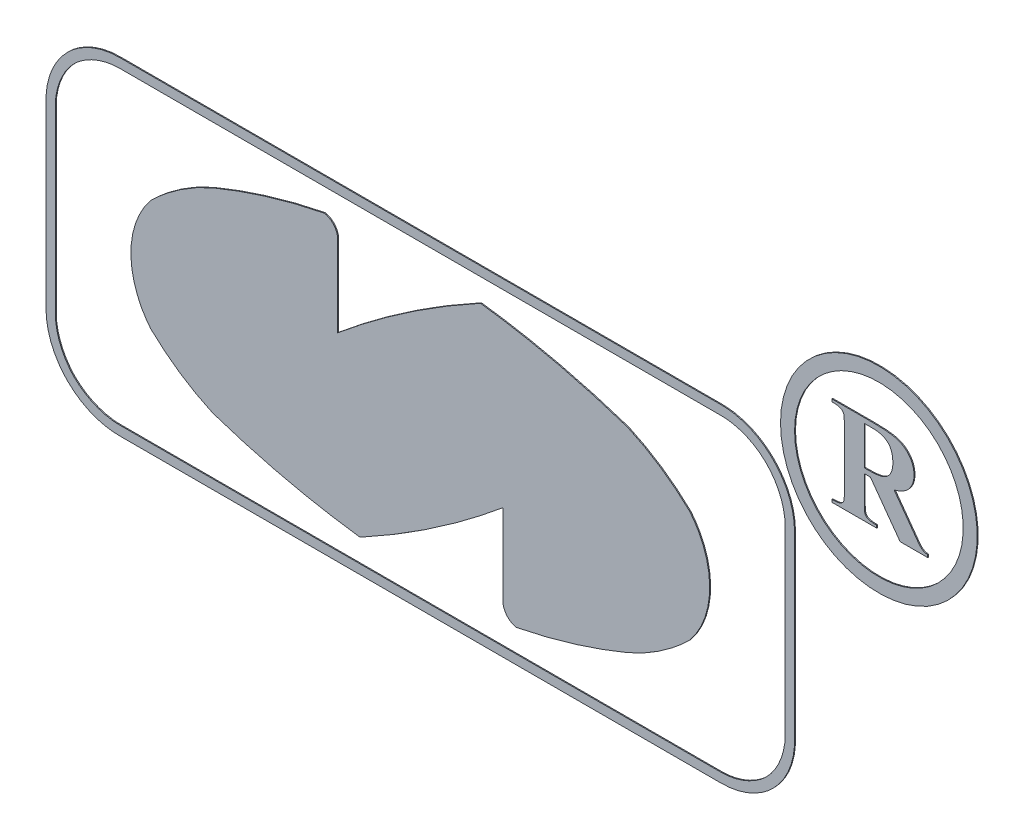
from build123d import *

# Parameters (mm, degrees)
SKETCH_1_R        = 1.05
SKETCH_1_R_2      = 0.9
EXTRUDE_1_DEPTH   = 0.01
EXTRUDE_1_2_DEPTH = 0.01
EXTRUDE_1_3_DEPTH = 0.01
EXTRUDE_2_DEPTH   = 0.01


with BuildPart() as part:
    # Эскиз1 → Вытянуть1 (new body)
    with BuildSketch(Plane.XY):
        with Locations(Location((4.87, 1.9247, 0), (0, 0, 180))):
            Circle(SKETCH_1_R)
        with Locations(Location((4.87, 1.9247, 0), (0, 0, 180))):
            Circle(SKETCH_1_R_2, mode=Mode.SUBTRACT)
    extrude(amount=EXTRUDE_1_DEPTH)


with BuildPart() as body_2:
    # Эскиз1 → Extrude 1 2 (new body)
    with BuildSketch(Plane.XY):
        with BuildLine():
            Line((3.1861, 1.7736), (-3.2358, 1.7736))
            add(Edge.make_bspline(
                [(-3.2358, 1.7736), (-3.444, 1.7736), (-3.6433, 1.6909), (-3.7904, 1.544)],
                knots=[0, 0, 0, 0, 0.5, 0.5, 0.5, 0.5], degree=3))
            add(Edge.make_bspline(
                [(-3.7904, 1.544), (-3.9374, 1.3968), (-4.0201, 1.1976), (-4.0201, 0.9894)],
                knots=[0.5, 0.5, 0.5, 0.5, 1, 1, 1, 1], degree=3))
            Line((-4.0201, 0.9894), (-4.0201, -0.94))
            add(Edge.make_bspline(
                [(-4.0201, -0.94), (-4.0201, -1.1481), (-3.9374, -1.3474), (-3.7904, -1.4946)],
                knots=[0, 0, 0, 0, 0.5, 0.5, 0.5, 0.5], degree=3))
            add(Edge.make_bspline(
                [(-3.7904, -1.4946), (-3.6433, -1.6415), (-3.444, -1.7242), (-3.2358, -1.7242)],
                knots=[0.5, 0.5, 0.5, 0.5, 1, 1, 1, 1], degree=3))
            Line((-3.2358, -1.7242), (3.1861, -1.7242))
            add(Edge.make_bspline(
                [(3.1861, -1.7242), (3.3941, -1.7242), (3.5937, -1.6415), (3.7405, -1.4946)],
                knots=[0, 0, 0, 0, 0.5, 0.5, 0.5, 0.5], degree=3))
            add(Edge.make_bspline(
                [(3.7405, -1.4946), (3.8876, -1.3474), (3.97, -1.1481), (3.97, -0.94)],
                knots=[0.5, 0.5, 0.5, 0.5, 1, 1, 1, 1], degree=3))
            Line((3.97, -0.94), (3.97, 0.9894))
            add(Edge.make_bspline(
                [(3.97, 0.9894), (3.97, 1.4226), (3.6193, 1.7736), (3.1861, 1.7736)],
                knots=[0, 0, 0, 0, 1, 1, 1, 1], degree=3))
        make_face()
        with BuildLine():
            Line((3.1861, 1.6736), (-3.2358, 1.6736))
            add(Edge.make_bspline(
                [(-3.2358, 1.6736), (-3.410370349, 1.6736), (-3.596153303, 1.596632942), (-3.719689323, 1.473289283)],
                knots=[0, 0, 0, 0, 0.499937556, 0.499937556, 0.499937556, 0.499937556], degree=3))
            add(Edge.make_bspline(
                [(-3.719689323, 1.473289283), (-3.843042067, 1.349744337), (-3.9201, 1.163983084), (-3.9201, 0.9894)],
                knots=[0.500062392, 0.500062392, 0.500062392, 0.500062392, 1, 1, 1, 1], degree=3))
            Line((-3.9201, 0.9894), (-3.9201, -0.94))
            add(Edge.make_bspline(
                [(-3.9201, -0.94), (-3.9201, -1.114583084), (-3.843042054, -1.300344326), (-3.719689322, -1.423889284)],
                knots=[0, 0, 0, 0, 0.499937603, 0.499937603, 0.499937603, 0.499937603], degree=3))
            add(Edge.make_bspline(
                [(-3.719689322, -1.423889284), (-3.596153301, -1.547232943), (-3.410370348, -1.6242), (-3.2358, -1.6242)],
                knots=[0.500062446, 0.500062446, 0.500062446, 0.500062446, 1, 1, 1, 1], degree=3))
            Line((-3.2358, -1.6242), (3.1861, -1.6242))
            add(Edge.make_bspline(
                [(3.1861, -1.6242), (3.360598263, -1.6242), (3.546418364, -1.547344312), (3.66976525, -1.423913402)],
                knots=[0, 0, 0, 0, 0.5, 0.5, 0.5, 0.5], degree=3))
            add(Edge.make_bspline(
                [(3.66976525, -1.423913402), (3.793161608, -1.300433158), (3.87, -1.11456806), (3.87, -0.94)],
                knots=[0.5, 0.5, 0.5, 0.5, 1, 1, 1, 1], degree=3))
            Line((3.87, -0.94), (3.87, 0.9894))
            add(Edge.make_bspline(
                [(3.87, 0.9894), (3.87, 1.163950336), (3.724237773, 1.527740864), (3.360606985, 1.6736), (3.1861, 1.6736)],
                knots=[0, 0, 0, 0, 0.5, 1, 1, 1, 1], degree=3))
        make_face(mode=Mode.SUBTRACT)
    extrude(amount=EXTRUDE_1_2_DEPTH)


with BuildPart() as body_3:
    # Эскиз1 → Extrude 1 3 (new body)
    with BuildSketch(Plane.XY):
        with BuildLine():
            add(Edge.make_bspline(
                [(0.9967, -1.3782), (1.4053, -1.2975), (1.8056, -1.1761), (2.1907, -1.0161)],
                knots=[0, 0, 0, 0, 1, 1, 1, 1], degree=3))
            add(Edge.make_bspline(
                [(2.1907, -1.0161), (2.437, -0.9085), (2.6613, -0.7572), (2.8527, -0.5684)],
                knots=[0, 0, 0, 0, 1, 1, 1, 1], degree=3))
            add(Edge.make_bspline(
                [(2.8527, -0.5684), (3.1345, -0.2231), (3.1345, 0.2726), (2.8527, 0.6182)],
                knots=[0, 0, 0, 0, 1, 1, 1, 1], degree=3))
            add(Edge.make_bspline(
                [(2.8527, 0.6182), (2.6593, 0.8043), (2.4356, 0.9552), (2.1907, 1.0655)],
                knots=[0, 0, 0, 0, 1, 1, 1, 1], degree=3))
            add(Edge.make_bspline(
                [(2.1907, 1.0655), (1.6796, 1.2378), (1.153, 1.3591), (0.6183, 1.4276)],
                knots=[0, 0, 0, 0, 1, 1, 1, 1], degree=3))
            add(Edge.make_bspline(
                [(0.6183, 1.4276), (0.0768, 1.1332), (-0.4347, 0.786), (-0.9077, 0.3913)],
                knots=[0, 0, 0, 0, 1, 1, 1, 1], degree=3))
            add(Edge.make_bspline(
                [(-0.9061, 1.2538), (-0.9072, 0.9665), (-0.9077, 0.6789), (-0.9077, 0.3913)],
                knots=[0, 0, 0, 0, 1, 1, 1, 1], degree=3))
            add(Edge.make_bspline(
                [(-0.9061, 1.2538), (-0.9069, 1.3373), (-0.9647, 1.4091), (-1.0459, 1.4276)],
                knots=[0, 0, 0, 0, 1, 1, 1, 1], degree=3))
            add(Edge.make_bspline(
                [(-1.0459, 1.4276), (-1.4554, 1.347), (-1.8555, 1.2255), (-2.2404, 1.0655)],
                knots=[0, 0, 0, 0, 1, 1, 1, 1], degree=3))
            add(Edge.make_bspline(
                [(-2.2404, 1.0655), (-2.4868, 0.9579), (-2.711, 0.8066), (-2.9025, 0.6182)],
                knots=[0, 0, 0, 0, 1, 1, 1, 1], degree=3))
            add(Edge.make_bspline(
                [(-2.9025, 0.6182), (-3.1842, 0.2726), (-3.1842, -0.2231), (-2.9025, -0.5684)],
                knots=[0, 0, 0, 0, 1, 1, 1, 1], degree=3))
            add(Edge.make_bspline(
                [(-2.9025, -0.5684), (-2.7089, -0.7549), (-2.4852, -0.9058), (-2.2404, -1.0161)],
                knots=[0, 0, 0, 0, 1, 1, 1, 1], degree=3))
            add(Edge.make_bspline(
                [(-2.2404, -1.0161), (-1.7292, -1.1883), (-1.2029, -1.3097), (-0.6679, -1.3782)],
                knots=[0, 0, 0, 0, 1, 1, 1, 1], degree=3))
            add(Edge.make_bspline(
                [(-0.6679, -1.3782), (-0.1262, -1.0837), (0.3846, -0.7366), (0.8579, -0.3419)],
                knots=[0, 0, 0, 0, 1, 1, 1, 1], degree=3))
            add(Edge.make_bspline(
                [(0.8579, -0.3419), (0.8571, -0.6292), (0.8567, -0.9163), (0.8567, -1.2034)],
                knots=[0, 0, 0, 0, 1, 1, 1, 1], degree=3))
            add(Edge.make_bspline(
                [(0.8567, -1.2034), (0.8567, -1.2872), (0.9147, -1.3597), (0.9967, -1.3782)],
                knots=[0, 0, 0, 0, 1, 1, 1, 1], degree=3))
        make_face()
    extrude(amount=EXTRUDE_1_3_DEPTH)


with BuildPart() as body_4:
    # Эскиз2 → Вытянуть2 (new body)
    with BuildSketch(Plane.XY.offset(0.01)):
        with BuildLine():
            Line((4.723994939, 1.911304465), (4.723994939, 1.632567531))
            add(Edge.make_bspline(
                [(4.723994939, 1.632567531), (4.724042224, 1.626828939), (4.724132818, 1.615834295), (4.724603646, 1.600214007), (4.72499915, 1.586215654), (4.726469799, 1.574012896), (4.727495069, 1.563380433), (4.729229602, 1.554472005), (4.730930808, 1.5471125), (4.733983227, 1.539658169), (4.738986561, 1.531870595), (4.746529764, 1.523673639), (4.756029382, 1.516680271), (4.767657983, 1.510221655), (4.782985454, 1.505200511), (4.803067788, 1.502367813), (4.828117817, 1.499939862), (4.846624799, 1.499872453), (4.856726813, 1.499835658)],
                knots=[0, 0, 0, 0, 1.201607785, 2.302176191, 3.273050139, 4.131548176, 4.87492358, 5.508079405, 6.031227576, 6.453276293, 7.188288546, 7.956616343, 8.773076426, 9.647656452, 10.732595485, 12.127198207, 13.886035732, 16, 16, 16, 16], degree=3))
            Line((4.856726813, 1.499835658), (4.856726813, 1.473289283))
            Line((4.856726813, 1.473289283), (4.378892069, 1.473289283))
            Line((4.378892069, 1.473289283), (4.378892069, 1.499835658))
            add(Edge.make_bspline(
                [(4.378892069, 1.499835658), (4.38906101, 1.499884912), (4.407701951, 1.499975202), (4.432926523, 1.502262865), (4.45296287, 1.505436472), (4.468284136, 1.510419462), (4.479721686, 1.517059694), (4.489120435, 1.524141597), (4.496558443, 1.53226068), (4.501684501, 1.539906), (4.504642878, 1.547264195), (4.506443756, 1.554528262), (4.508040419, 1.563400861), (4.50951044, 1.573979694), (4.510503025, 1.586234146), (4.511052828, 1.600210124), (4.511475119, 1.615835425), (4.511572904, 1.626829326), (4.511623942, 1.632567531)],
                knots=[0, 0, 0, 0, 2.130106643, 3.904752054, 5.302927616, 6.375002966, 7.257314602, 8.062903242, 8.831833611, 9.555194011, 9.977573727, 10.487113911, 11.120766299, 11.86655625, 12.724382924, 13.696018294, 14.797449837, 16, 16, 16, 16], degree=3))
            Line((4.511623942, 1.632567531), (4.511623942, 2.269680523))
            add(Edge.make_bspline(
                [(4.511623942, 2.269680523), (4.511572937, 2.275418736), (4.511475214, 2.286412656), (4.511052501, 2.302037837), (4.51050404, 2.316014196), (4.509507309, 2.328267471), (4.508049831, 2.338849863), (4.506404598, 2.347777888), (4.504685202, 2.355135261), (4.50163684, 2.362589814), (4.496632778, 2.370379049), (4.489085661, 2.378567927), (4.479555113, 2.385630817), (4.467843188, 2.391930151), (4.45256738, 2.397047558), (4.43258272, 2.400219438), (4.407484347, 2.402193535), (4.388990291, 2.402335099), (4.378892069, 2.402412396)],
                knots=[0, 0, 0, 0, 1.201552591, 2.302070444, 3.272899798, 4.130014864, 4.875186147, 5.50831289, 6.031437031, 6.453466362, 7.188444853, 7.956737359, 8.773159939, 9.660425799, 10.731611811, 12.128627521, 13.886132833, 16, 16, 16, 16], degree=3))
            Line((4.378892069, 2.402412396), (4.378892069, 2.428958771))
            Line((4.378892069, 2.428958771), (4.821055122, 2.428958771))
            add(Edge.make_bspline(
                [(4.821055122, 2.428958771), (4.834950968, 2.428863884), (4.861847877, 2.42868022), (4.900712701, 2.427710184), (4.936675201, 2.425866909), (4.969742151, 2.423222448), (4.999892291, 2.419697585), (5.027249899, 2.4156447), (5.051609406, 2.410701621), (5.073474441, 2.405109805), (5.093331513, 2.398293987), (5.112083208, 2.390533297), (5.129680032, 2.381020149), (5.146666061, 2.370712688), (5.162569472, 2.358846997), (5.177654336, 2.345772175), (5.191427491, 2.331125888), (5.204561665, 2.315682127), (5.216347731, 2.299096851), (5.226731434, 2.281713292), (5.235491231, 2.263603682), (5.242551931, 2.244770264), (5.248182657, 2.225299765), (5.252129304, 2.205037021), (5.254401394, 2.184079251), (5.254747363, 2.169860525), (5.254922433, 2.16266545)],
                knots=[0, 0, 0, 0, 1.72662054, 3.342060189, 4.830092444, 6.200416371, 7.462989327, 8.601282075, 9.635622143, 10.550256632, 11.403195303, 12.242354894, 13.068488357, 13.886138304, 14.709050263, 15.530840692, 16.363158174, 17.204513028, 18.048276074, 18.887963052, 19.717794674, 20.544196029, 21.384278329, 22.233315354, 23.106007916, 24, 24, 24, 24], degree=3))
            add(Edge.make_bspline(
                [(5.254922433, 2.16266545), (5.254674562, 2.153943557), (5.254188537, 2.136841654), (5.250621049, 2.111733304), (5.244575503, 2.087845646), (5.236320143, 2.065037796), (5.225360663, 2.043561465), (5.212225321, 2.023090873), (5.19668469, 2.003713154), (5.184676604, 1.992065959), (5.178601605, 1.986173537)],
                knots=[0, 0, 0, 0, 1.055875917, 2.070363217, 3.063103869, 4.034981426, 5.000784238, 5.975972407, 6.976026164, 8, 8, 8, 8], degree=3))
            add(Edge.make_bspline(
                [(5.178601605, 1.986173537), (5.169888012, 1.978965789), (5.151804569, 1.964007448), (5.119423997, 1.946583212), (5.082706616, 1.931213636), (5.056066179, 1.923860002), (5.042136648, 1.920014994)],
                knots=[0, 0, 0, 0, 0.884570304, 1.835761235, 2.868380718, 4, 4, 4, 4], degree=3))
            Line((5.042136648, 1.920014994), (5.272136097, 1.602288072))
            add(Edge.make_bspline(
                [(5.272136097, 1.602288072), (5.275737674, 1.597315597), (5.282591993, 1.587852259), (5.29229351, 1.574235728), (5.301432338, 1.562264368), (5.309722292, 1.551682199), (5.317096406, 1.542541168), (5.32385802, 1.534977629), (5.329676112, 1.528818706), (5.333505393, 1.525394231), (5.335183737, 1.52389331)],
                knots=[0, 0, 0, 0, 1.4621376, 2.782658633, 3.981171578, 5.048212647, 5.984136403, 6.77709185, 7.464008716, 8, 8, 8, 8], degree=3))
            add(Edge.make_bspline(
                [(5.335183737, 1.52389331), (5.339990082, 1.520471053), (5.349570844, 1.513649272), (5.365784375, 1.506503159), (5.38295824, 1.501530664), (5.394879624, 1.500406142), (5.400927493, 1.499835658)],
                knots=[0, 0, 0, 0, 0.994168701, 1.981733386, 2.976107756, 4, 4, 4, 4], degree=3))
            Line((5.400927493, 1.499835658), (5.400927493, 1.473289283))
            Line((5.400927493, 1.473289283), (5.106843436, 1.473289283))
            Line((5.106843436, 1.473289283), (4.789738695, 1.911304465))
            Line((4.789738695, 1.911304465), (4.723994939, 1.911304465))
        make_face()
        with BuildLine():
            Line((4.723994939, 2.375866021), (4.723994939, 1.964397214))
            Line((4.723994939, 1.964397214), (4.76609583, 1.964397214))
            add(Edge.make_bspline(
                [(4.76609583, 1.964397214), (4.774392194, 1.964419732), (4.790436498, 1.96446328), (4.813745845, 1.965286714), (4.835386062, 1.966762402), (4.855456178, 1.968569013), (4.87387443, 1.971000431), (4.890670173, 1.9741531), (4.905877033, 1.977572595), (4.923719882, 1.983036015), (4.944005304, 1.991902811), (4.965948353, 2.006045928), (4.984714483, 2.024282386), (5.000975538, 2.045688899), (5.013896906, 2.070841281), (5.022892056, 2.099592383), (5.02828759, 2.131700422), (5.028938006, 2.154209114), (5.029278248, 2.165983747)],
                knots=[0, 0, 0, 0, 1.034226387, 2.000086228, 2.907011593, 3.737991848, 4.511957121, 5.221904592, 5.867871331, 6.453975968, 7.546048523, 8.616933773, 9.689759286, 10.791177541, 11.955248141, 13.195348709, 14.532845086, 16, 16, 16, 16], degree=3))
            add(Edge.make_bspline(
                [(5.029278248, 2.165983747), (5.029130553, 2.174632031), (5.028843961, 2.19141341), (5.026313786, 2.215677075), (5.02230922, 2.238284259), (5.016157436, 2.259039616), (5.008890024, 2.278313365), (4.999421716, 2.295542952), (4.988596762, 2.311208468), (4.975794449, 2.324906065), (4.961317282, 2.33725561), (4.944528192, 2.347449573), (4.926015318, 2.356555298), (4.905240729, 2.363441856), (4.882561093, 2.369011808), (4.857896832, 2.373195446), (4.83111842, 2.375364064), (4.812624652, 2.375694346), (4.803011883, 2.375866021)],
                knots=[0, 0, 0, 0, 1.16430214, 2.25924543, 3.281782595, 4.251104685, 5.170830437, 6.049791735, 6.891787854, 7.728466103, 8.567626776, 9.445897571, 10.366094373, 11.340588595, 12.386009021, 13.509395102, 14.705422703, 16, 16, 16, 16], degree=3))
            Line((4.803011883, 2.375866021), (4.723994939, 2.375866021))
        make_face(mode=Mode.SUBTRACT)
    extrude(amount=EXTRUDE_2_DEPTH)


solid = Compound([part.part, body_2.part, body_3.part, body_4.part])
